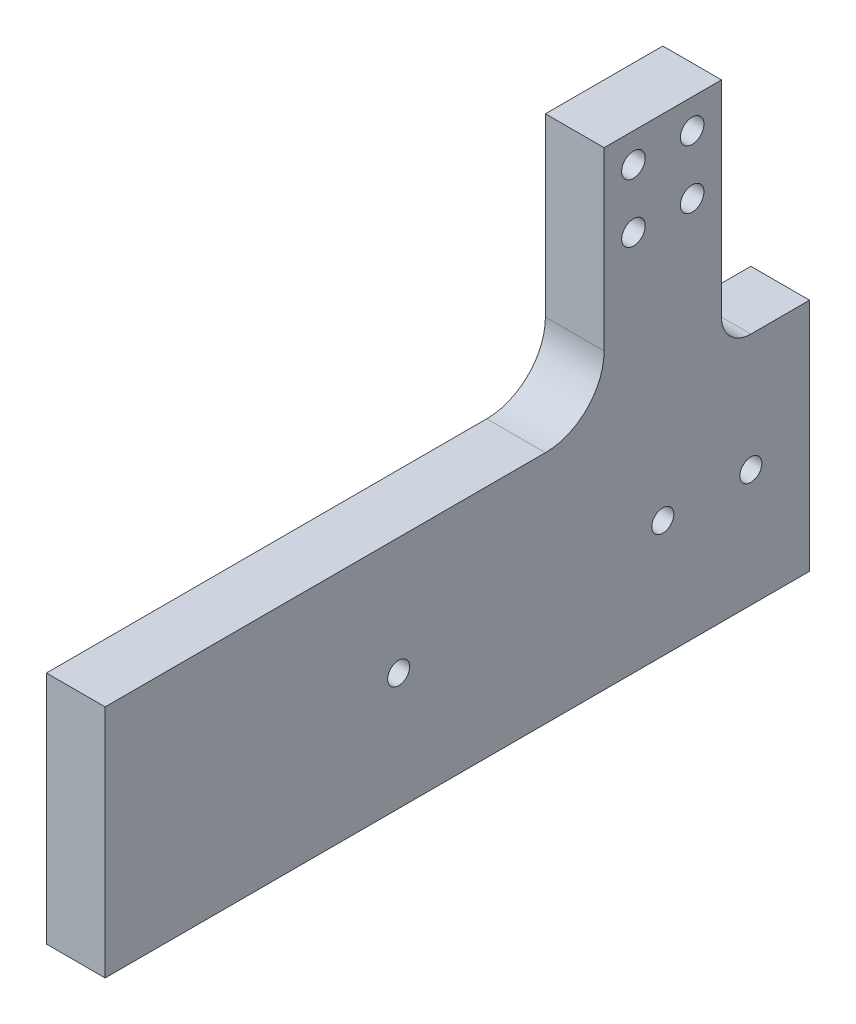
from build123d import *

# Parameters (mm, degrees)
SKETCH1_R              = 2.38125
BOSS_EXTRUDE1_DEPTH    = 12.7
F_10_CLEARANCE_HOLE1_D = 5.1054
FILLET1_R              = 12.7
FILLET2_R              = 6.35


with BuildPart() as part:
    # Sketch1 → Boss-Extrude1 (new body)
    with BuildSketch(Plane(origin=(0, 0, 0), x_dir=(0, 0, -1), z_dir=(1, 0, 0))):
        Polygon((-19.05, 101.6), (-44.45, 101.6), (-44.45, 50.8), (-152.4, 50.8), (-152.4, 0), (0, 0), (0, 50.8), (-19.05, 50.8), align=None)
        with Locations((-88.9, 25.4)):
            Circle(SKETCH1_R, mode=Mode.SUBTRACT)
        with Locations((-31.75, 25.4)):
            Circle(SKETCH1_R, mode=Mode.SUBTRACT)
        with Locations((-12.7, 25.4)):
            Circle(SKETCH1_R, mode=Mode.SUBTRACT)
    extrude(amount=BOSS_EXTRUDE1_DEPTH)

    # #10 Clearance Hole1 (through all)
    with Locations(Plane(origin=(12.7, 0, 0), x_dir=(0, 0, -1), z_dir=(1, 0, 0))):
        with Locations((-38.1, 95.25), (-25.4, 95.25), (-25.4, 82.55), (-38.1, 82.55)):
            Hole(F_10_CLEARANCE_HOLE1_D / 2)

    # Fillet1
    fillet1_edges = [part.edges().sort_by_distance(p)[0] for p in [
        (6.35, 50.8, 44.45),
    ]]
    fillet(fillet1_edges, radius=FILLET1_R)

    # Fillet2
    fillet2_edges = [part.edges().sort_by_distance(p)[0] for p in [
        (6.35, 50.8, 19.05),
    ]]
    fillet(fillet2_edges, radius=FILLET2_R)


solid = part.part
